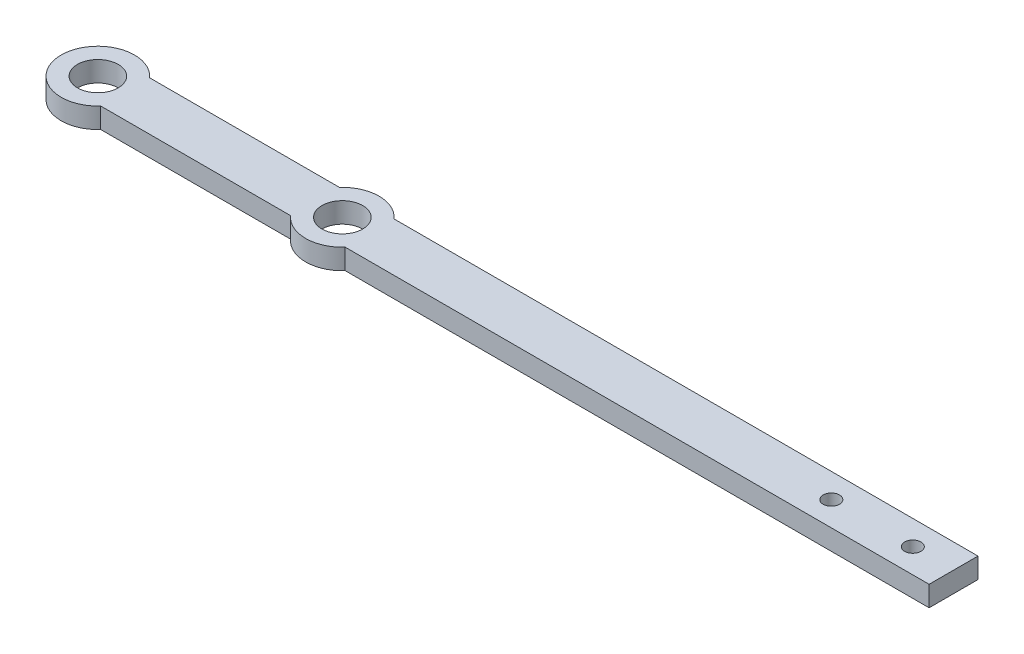
from build123d import *

# Parameters (mm, degrees)
BOSS_EXTRUDE1_DEPTH = 5
SKETCH2_R           = 5
SKETCH2_R_2         = 2
CUT_EXTRUDE1_DEPTH  = 211.252229477


with BuildPart() as part:
    # Sketch1 → Boss-Extrude1 (new body)
    with BuildSketch(Plane(origin=(0, 0, 0), x_dir=(1, 0, 0), z_dir=(0, 1, 0))):
        with BuildLine():
            Line((6.708203932, 6), (53.291796068, 6))
            ThreePointArc((53.291796068, 6), (60, 9), (66.708203932, 6))
            Line((66.708203932, 6), (210, 6))
            Line((210, 6), (210, -6))
            Line((210, -6), (66.708203932, -6))
            ThreePointArc((66.708203932, -6), (60, -9), (53.291796068, -6))
            Line((53.291796068, -6), (6.708203932, -6))
            ThreePointArc((6.708203932, -6), (-9, 0), (6.708203932, 6))
        make_face()
    extrude(amount=BOSS_EXTRUDE1_DEPTH)

    # Sketch2 → Cut-Extrude1 (cut, through all)
    with BuildSketch(Plane(origin=(0, 5, 0), x_dir=(1, 0, 0), z_dir=(0, 1, 0))):
        with Locations(Location((0, 0, 0), (0, 0, 270))):
            Circle(SKETCH2_R)
        with Locations(Location((60, 0, 0), (0, 0, 270))):
            Circle(SKETCH2_R)
        with Locations(Location((200, 0, 0), (0, 0, 270))):
            Circle(SKETCH2_R_2)
        with Locations(Location((180, 0, 0), (0, 0, 270))):
            Circle(SKETCH2_R_2)
    extrude(amount=-CUT_EXTRUDE1_DEPTH, mode=Mode.SUBTRACT)


solid = part.part
